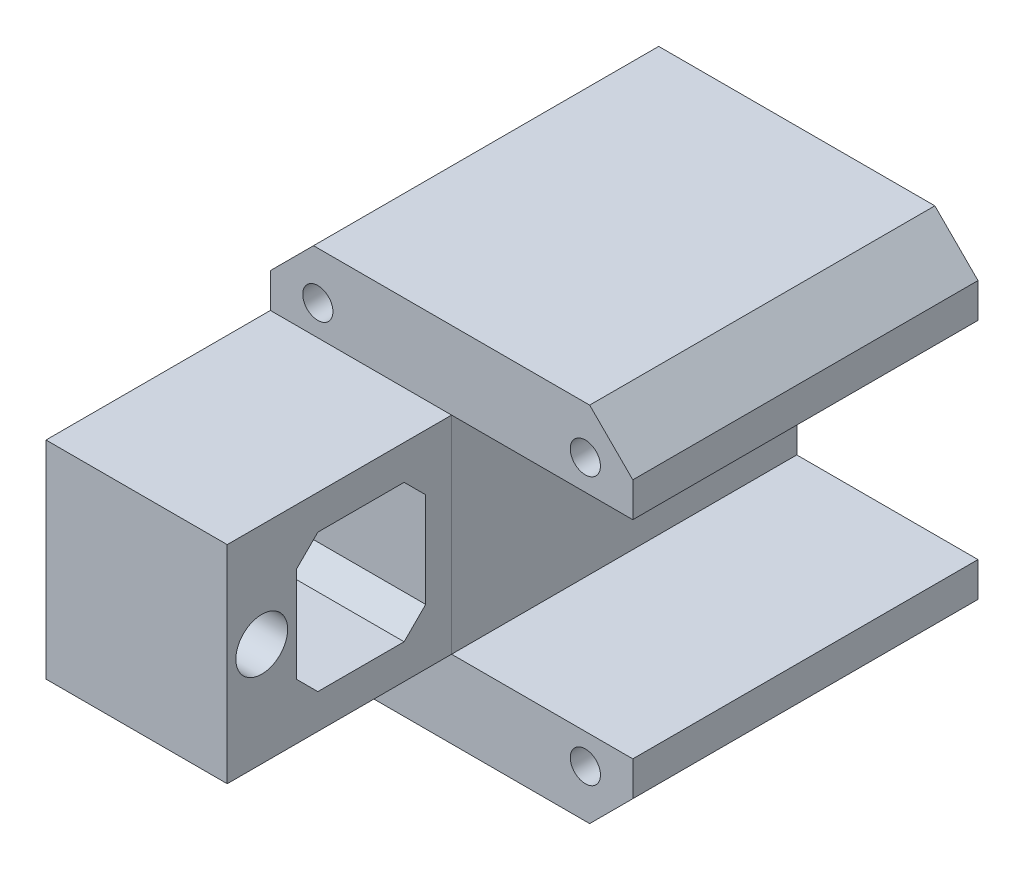
from build123d import *

# Parameters (mm, degrees)
SKETCH_1_W          = 42
SKETCH_1_H          = 42
EXTRUDE_1_DEPTH     = 40
CHAMFER_1_SIZE      = 5
SKETCH_4_R          = 1.75
CUT_EXTRUDE_1_DEPTH = 3
SKETCH_5_W          = 26
SKETCH_5_H          = 24
SKETCH_5_W_2        = 15
SKETCH_5_H_2        = 16
EXTRUDE_2_DEPTH     = 21
SKETCH_7_W          = 40
SKETCH_7_H          = 24
CUT_EXTRUDE_3_DEPTH = 21
SKETCH_6_R          = 3
CUT_EXTRUDE_2_DEPTH = 10
CHAMFER_2_SIZE      = 2.5


with BuildPart() as part:
    # 草圖1 → 填料-伸長1 (new body)
    with BuildSketch(Plane.XY):
        Rectangle(SKETCH_1_W, SKETCH_1_H)
    extrude(amount=EXTRUDE_1_DEPTH)

    # 導角1
    chamfer_1_edges = [part.edges().sort_by_distance(p)[0] for p in [
        (-21, 21, 20),
        (21, 21, 20),
        (21, -21, 20),
        (-21, -21, 20),
    ]]
    chamfer(chamfer_1_edges, length=CHAMFER_1_SIZE)

    # 草圖4 → 除料-伸長1 (cut)
    with BuildSketch(Plane.XY.offset(40)):
        with Locations((-15.5, 15.5)):
            Circle(SKETCH_4_R)
        with Locations(Location((-15.5, -15.5, 0), (0, 0, 180))):
            Circle(SKETCH_4_R)
        with Locations((15.5, -15.5)):
            Circle(SKETCH_4_R)
        with Locations(Location((15.5, 15.5, 0), (0, 0, 180))):
            Circle(SKETCH_4_R)
    extrude(amount=-CUT_EXTRUDE_1_DEPTH, mode=Mode.SUBTRACT)

    # 草圖7 → 除料-伸長3 (cut)
    with BuildSketch(Plane(origin=(21, 0, 0), x_dir=(0, 0, -1), z_dir=(1, 0, 0))):
        with Locations((-20, 0)):
            Rectangle(SKETCH_7_W, SKETCH_7_H)
    extrude(amount=-CUT_EXTRUDE_3_DEPTH, mode=Mode.SUBTRACT)


with BuildPart() as body_2:
    # 草圖5 → 填料-伸長2 (new body)
    with BuildSketch(Plane.ZY.offset(21)):
        with Locations((53, 0)):
            Rectangle(SKETCH_5_W, SKETCH_5_H)
        with Locations((50.5, 0)):
            Rectangle(SKETCH_5_W_2, SKETCH_5_H_2, mode=Mode.SUBTRACT)
    extrude(amount=-EXTRUDE_2_DEPTH)


with BuildPart() as cut_extrude_2_tool:
    # 草圖6 → 除料-伸長2 (new body)
    with BuildSketch(Plane(origin=(0, 0, 0), x_dir=(0, 0, -1), z_dir=(1, 0, 0))):
        with Locations((-62, 0)):
            Circle(SKETCH_6_R)
        with Locations((-18.5, 0)):
            Circle(SKETCH_6_R)
    extrude(amount=-CUT_EXTRUDE_2_DEPTH)


with BuildPart() as part_1:
    add(part.part)

    # 除料-伸長2: cut by cut_extrude_2_tool
    add(cut_extrude_2_tool.part, mode=Mode.SUBTRACT)


with BuildPart() as body_2_1:
    add(body_2.part)

    # 除料-伸長2: cut by cut_extrude_2_tool
    add(cut_extrude_2_tool.part, mode=Mode.SUBTRACT)

    # 導角2
    chamfer_2_edges = [body_2_1.edges().sort_by_distance(p)[0] for p in [
        (-10.5, -8, 43),
        (-10.5, 8, 43),
        (-10.5, 8, 58),
        (-10.5, -8, 58),
    ]]
    chamfer(chamfer_2_edges, length=CHAMFER_2_SIZE)


solid = Compound([part_1.part, body_2_1.part])
